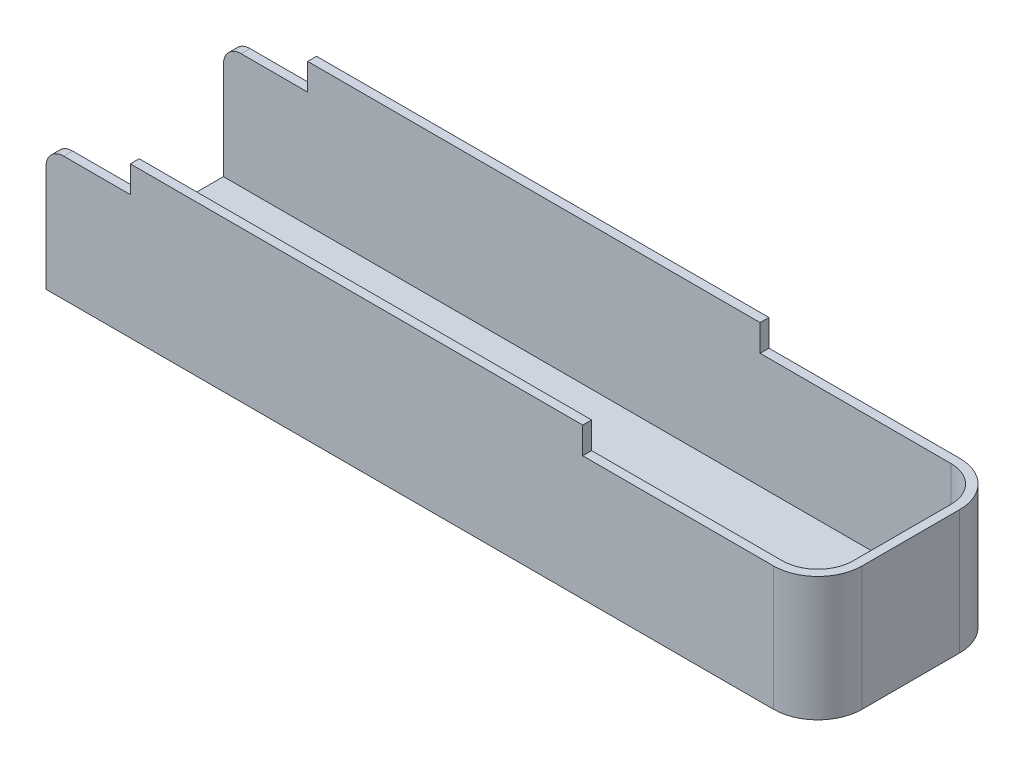
from build123d import *

# Parameters (mm, degrees)
EXTRUDE_1_DEPTH     = 17
EXTRUDE_2_DEPTH     = 1
SKETCH_3_W          = 13.083033948
SKETCH_3_H          = 19
CUT_EXTRUDE_1_DEPTH = 16
SKETCH_4_W          = 26.5
SKETCH_4_H          = 3
CUT_EXTRUDE_2_DEPTH = 26
SKETCH_5_W          = 9.5
SKETCH_5_H          = 3
CUT_EXTRUDE_3_DEPTH = 26
FILLET_1_R          = 2


with BuildPart() as part:
    # Эскиз1 → Бобышка-Вытянуть1 (new body)
    with BuildSketch(Plane(origin=(0, 0, 0), x_dir=(1, 0, 0), z_dir=(0, 1, 0))):
        with BuildLine():
            Line((38.5, 10.5), (-43.5, 10.5))
            Line((-43.5, 10.5), (-43.5, -10.5))
            Line((-43.5, -10.5), (38.5, -10.5))
            ThreePointArc((38.5, -10.5), (42.035533906, -9.035533906), (43.5, -5.5))
            Line((43.5, -5.5), (43.5, 5.5))
            ThreePointArc((43.5, 5.5), (42.035533906, 9.035533906), (38.5, 10.5))
        make_face()
        with BuildLine():
            Line((-42.5, 9.5), (-42.5, -9.5))
            Line((-42.5, -9.5), (38.5, -9.5))
            ThreePointArc((38.5, -9.5), (41.328427125, -8.328427125), (42.5, -5.5))
            Line((42.5, -5.5), (42.5, 5.5))
            ThreePointArc((42.5, 5.5), (41.328427125, 8.328427125), (38.5, 9.5))
            Line((38.5, 9.5), (-42.5, 9.5))
        make_face(mode=Mode.SUBTRACT)
    extrude(amount=EXTRUDE_1_DEPTH)

    # Эскиз2 → Бобышка-Вытянуть2 (add)
    with BuildSketch(Plane.XZ):
        with BuildLine():
            Line((-43.5, 10.5), (-43.5, -10.5))
            Line((-43.5, -10.5), (38.5, -10.5))
            ThreePointArc((38.5, -10.5), (42.035533906, -9.035533906), (43.5, -5.5))
            Line((43.5, -5.5), (43.5, 5.5))
            ThreePointArc((43.5, 5.5), (42.035533906, 9.035533906), (38.5, 10.5))
            Line((38.5, 10.5), (-43.5, 10.5))
        make_face()
    extrude(amount=-EXTRUDE_2_DEPTH)

    # Эскиз3 → Вырез-Вытянуть1 (cut)
    with BuildSketch(Plane(origin=(0, 17, 0), x_dir=(1, 0, 0), z_dir=(0, 1, 0))):
        with Locations((-45.110446102, 0)):
            Rectangle(SKETCH_3_W, SKETCH_3_H)
    extrude(amount=-CUT_EXTRUDE_1_DEPTH, mode=Mode.SUBTRACT)

    # Эскиз4 → Вырез-Вытянуть2 (cut)
    with BuildSketch(Plane.XY.offset(10.5)):
        with Locations((30.25, 15.5)):
            Rectangle(SKETCH_4_W, SKETCH_4_H)
    extrude(amount=-CUT_EXTRUDE_2_DEPTH, mode=Mode.SUBTRACT)

    # Эскиз5 → Вырез-Вытянуть3 (cut)
    with BuildSketch(Plane.XY.offset(10.5)):
        with Locations((-38.75, 15.5)):
            Rectangle(SKETCH_5_W, SKETCH_5_H)
    extrude(amount=-CUT_EXTRUDE_3_DEPTH, mode=Mode.SUBTRACT)

    # Скругление1
    fillet_1_edges = [part.edges().sort_by_distance(p)[0] for p in [
        (-43.5, 14, -10),
        (-43.5, 14, 10),
    ]]
    fillet(fillet_1_edges, radius=FILLET_1_R)


solid = part.part
